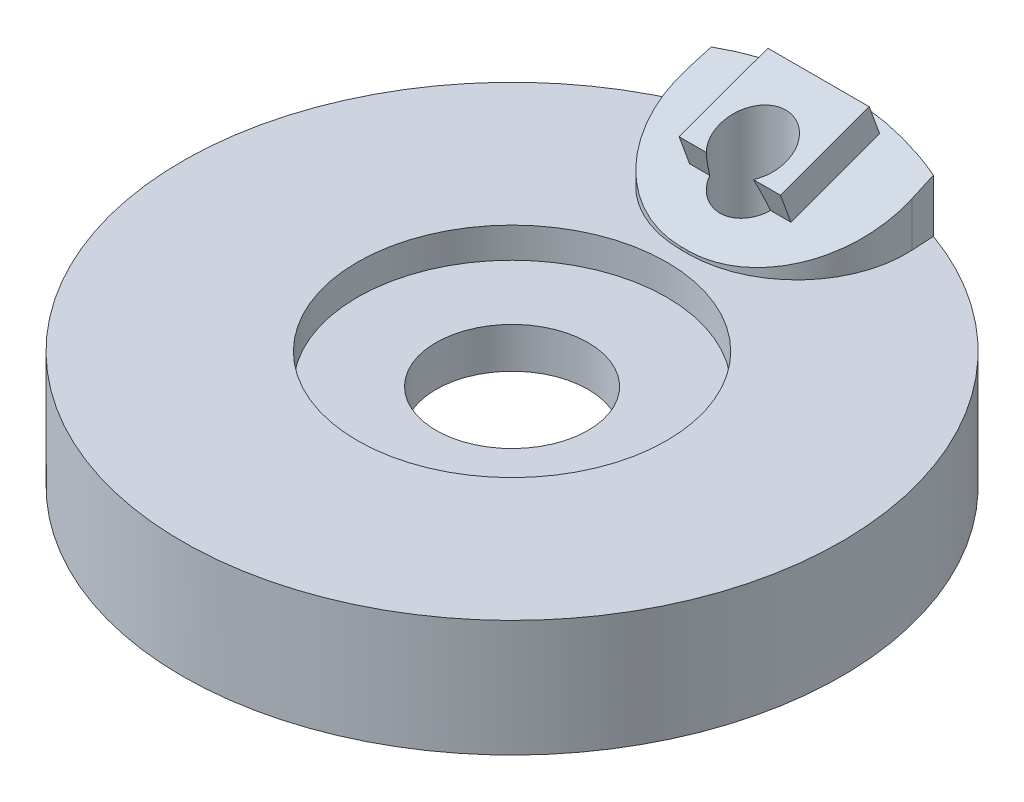
from build123d import *

# Parameters (mm, degrees)
BOSS_EXTRUDE1_START  = 47.2
SKETCH1_R            = 13
BOSS_EXTRUDE1_DEPTH  = 4.6
BOSS_EXTRUDE2_START  = -5.5
BOSS_EXTRUDE2_DEPTH  = 11
BOSS_EXTRUDE3_START  = -2
BOSS_EXTRUDE3_DEPTH  = 4
BOSS_EXTRUDE4_START  = 51.8
SKETCH4_R            = 25
SKETCH4_R_2          = 13
BOSS_EXTRUDE4_DEPTH  = 6.2
BOSS_EXTRUDE5_START  = 51.8
SKETCH5_W            = 40
SKETCH5_H            = 100
BOSS_EXTRUDE5_DEPTH  = 6.2
BOSS_EXTRUDE6_START  = 46.7
BOSS_EXTRUDE6_DEPTH  = 2.3
BOSS_EXTRUDE7_START  = 46.7
BOSS_EXTRUDE7_DEPTH  = 2.3
BOSS_EXTRUDE8_START  = 46.7
SKETCH8_R            = 4.6
BOSS_EXTRUDE8_DEPTH  = 2.3
BOSS_EXTRUDE9_START  = 48.9
SKETCH9_R            = 3
BOSS_EXTRUDE9_DEPTH  = 1.8
BOSS_EXTRUDE10_START = 50.6
SKETCH10_R           = 6.1
BOSS_EXTRUDE10_DEPTH = 1.7
BOSS_EXTRUDE11_START = 48.9
BOSS_EXTRUDE11_DEPTH = 1.9
BOSS_EXTRUDE12_START = 48.9
BOSS_EXTRUDE12_DEPTH = 1.9
BOSS_EXTRUDE13_START = 48.9
BOSS_EXTRUDE13_DEPTH = 1.9
BOSS_EXTRUDE14_START = 48.9
BOSS_EXTRUDE14_DEPTH = 1.9
BOSS_EXTRUDE15_START = 47.1
SKETCH15_R           = 2.2
BOSS_EXTRUDE15_DEPTH = 1.9
BOSS_EXTRUDE16_START = 48.9
SKETCH16_R           = 1.3
BOSS_EXTRUDE16_DEPTH = 9.1


with BuildPart() as part:
    # Sketch1 → Boss-Extrude1 (new body)
    with BuildSketch(Plane(origin=(0, 0, 0), x_dir=(1, 0, 0), z_dir=(0, 1, 0)).offset(BOSS_EXTRUDE1_START)):
        with Locations(Location((0, 62, 0), (0, 0, 270))):
            Circle(SKETCH1_R)
    extrude(amount=BOSS_EXTRUDE1_DEPTH)

    # Sketch2 → Boss-Extrude2 (add)
    with BuildSketch(Plane(origin=(0, 0, 0), x_dir=(0, 0, -1), z_dir=(1, 0, 0)).offset(BOSS_EXTRUDE2_START)):
        Polygon((68.5, 51.8), (76.5, 51.8), (76.5, 54.711761874), align=None)
    extrude(amount=BOSS_EXTRUDE2_DEPTH)

    # Sketch3 → Boss-Extrude3 (add)
    with BuildSketch(Plane(origin=(0, 0, 0), x_dir=(0, 0, -1), z_dir=(1, 0, 0)).offset(BOSS_EXTRUDE3_START)):
        Polygon((71.017101007, 52.662940955), (74.517101007, 53.936836775), (74.089575828, 55.111452551), (70.589575828, 53.837556731), align=None)
    extrude(amount=BOSS_EXTRUDE3_DEPTH)


with BuildPart() as body_2:
    # Sketch4 → Boss-Extrude4 (new body)
    with BuildSketch(Plane(origin=(0, 0, 0), x_dir=(1, 0, 0), z_dir=(0, 1, 0)).offset(BOSS_EXTRUDE4_START)):
        with Locations(Location((0, 62, 0), (0, 0, 270))):
            Circle(SKETCH4_R)
        with Locations(Location((0, 62, 0), (0, 0, 270))):
            Circle(SKETCH4_R_2, mode=Mode.SUBTRACT)
    extrude(amount=BOSS_EXTRUDE4_DEPTH)


with BuildPart() as part_1:
    add(part.part)

    # Combine1: cut body 2
    add(body_2.part, mode=Mode.SUBTRACT)


with BuildPart() as body_2_2:
    # Sketch5 → Boss-Extrude5 (new body)
    with BuildSketch(Plane(origin=(0, 0, 0), x_dir=(1, 0, 0), z_dir=(0, 1, 0)).offset(BOSS_EXTRUDE5_START)):
        with Locations((0, 90)):
            Rectangle(SKETCH5_W, SKETCH5_H)
        with BuildLine():
            Line((-0.141041229, 68.8), (0.141041229, 68.8))
            ThreePointArc((0.141041229, 68.8), (3.2691437, 70.149580551), (4.433699076, 73.351174452))
            Line((4.433699076, 73.351174452), (2.310189394, 109.642685883))
            ThreePointArc((2.310189394, 109.642685883), (1.685892465, 110.980791938), (0.313604349, 111.525860556))
            Line((0.313604349, 111.525860556), (-0.313604349, 111.525860556))
            ThreePointArc((-0.313604349, 111.525860556), (-1.685892465, 110.980791938), (-2.310189394, 109.642685883))
            Line((-2.310189394, 109.642685883), (-4.433699076, 73.351174452))
            ThreePointArc((-4.433699076, 73.351174452), (-3.2691437, 70.149580551), (-0.141041229, 68.8))
        make_face(mode=Mode.SUBTRACT)
    extrude(amount=BOSS_EXTRUDE5_DEPTH)


with BuildPart() as part_2:
    add(part_1.part)

    # Combine2: cut body 2 2
    add(body_2_2.part, mode=Mode.SUBTRACT)


with BuildPart() as body_2_3:
    # Sketch6 → Boss-Extrude6 (new body)
    with BuildSketch(Plane(origin=(0, 0, 0), x_dir=(1, 0, 0), z_dir=(0, 1, 0)).offset(BOSS_EXTRUDE6_START)):
        Polygon((-5.798275606, 72.465180362), (10.465180362, 56.201724394), (5.798275606, 51.534819638), (-10.465180362, 67.798275606), align=None)
    extrude(amount=BOSS_EXTRUDE6_DEPTH)


with BuildPart() as part_3:
    add(part_2.part)

    # Combine3: cut body 2 3
    add(body_2_3.part, mode=Mode.SUBTRACT)


with BuildPart() as body_2_4:
    # Sketch7 → Boss-Extrude7 (new body)
    with BuildSketch(Plane(origin=(0, 0, 0), x_dir=(1, 0, 0), z_dir=(0, 1, 0)).offset(BOSS_EXTRUDE7_START)):
        Polygon((10.465180362, 67.798275606), (-5.798275606, 51.534819638), (-10.465180362, 56.201724394), (5.798275606, 72.465180362), align=None)
    extrude(amount=BOSS_EXTRUDE7_DEPTH)


with BuildPart() as part_4:
    add(part_3.part)

    # Combine4: cut body 2 4
    add(body_2_4.part, mode=Mode.SUBTRACT)


with BuildPart() as body_2_5:
    # Sketch8 → Boss-Extrude8 (new body)
    with BuildSketch(Plane(origin=(0, 0, 0), x_dir=(1, 0, 0), z_dir=(0, 1, 0)).offset(BOSS_EXTRUDE8_START)):
        with Locations(Location((0, 62, 0), (0, 0, 270))):
            Circle(SKETCH8_R)
    extrude(amount=BOSS_EXTRUDE8_DEPTH)


with BuildPart() as part_5:
    add(part_4.part)

    # Combine5: cut body 2 5
    add(body_2_5.part, mode=Mode.SUBTRACT)


with BuildPart() as body_2_6:
    # Sketch9 → Boss-Extrude9 (new body)
    with BuildSketch(Plane(origin=(0, 0, 0), x_dir=(1, 0, 0), z_dir=(0, 1, 0)).offset(BOSS_EXTRUDE9_START)):
        with Locations(Location((0, 62, 0), (0, 0, 90))):
            Circle(SKETCH9_R)
    extrude(amount=BOSS_EXTRUDE9_DEPTH)


with BuildPart() as part_6:
    add(part_5.part)

    # Combine6: cut body 2 6
    add(body_2_6.part, mode=Mode.SUBTRACT)


with BuildPart() as body_2_7:
    # Sketch10 → Boss-Extrude10 (new body)
    with BuildSketch(Plane(origin=(0, 0, 0), x_dir=(1, 0, 0), z_dir=(0, 1, 0)).offset(BOSS_EXTRUDE10_START)):
        with Locations(Location((0, 62, 0), (0, 0, 270))):
            Circle(SKETCH10_R)
    extrude(amount=BOSS_EXTRUDE10_DEPTH)


with BuildPart() as part_7:
    add(part_6.part)

    # Combine7: cut body 2 7
    add(body_2_7.part, mode=Mode.SUBTRACT)


with BuildPart() as body_2_8:
    # Sketch11 → Boss-Extrude11 (new body)
    with BuildSketch(Plane(origin=(0, 0, 0), x_dir=(1, 0, 0), z_dir=(0, 1, 0)).offset(BOSS_EXTRUDE11_START)):
        Polygon((5.374011537, 57.898780669), (7.707463915, 55.565328291), (6.434671709, 54.292536085), (4.101219331, 56.625988463), align=None)
    extrude(amount=BOSS_EXTRUDE11_DEPTH)


with BuildPart() as part_8:
    add(part_7.part)

    # Combine8: cut body 2 8
    add(body_2_8.part, mode=Mode.SUBTRACT)


with BuildPart() as body_2_9:
    # Sketch12 → Boss-Extrude12 (new body)
    with BuildSketch(Plane(origin=(0, 0, 0), x_dir=(1, 0, 0), z_dir=(0, 1, 0)).offset(BOSS_EXTRUDE12_START)):
        Polygon((-4.101219331, 56.625988463), (-6.434671709, 54.292536085), (-7.707463915, 55.565328291), (-5.374011537, 57.898780669), align=None)
    extrude(amount=BOSS_EXTRUDE12_DEPTH)


with BuildPart() as part_9:
    add(part_8.part)

    # Combine9: cut body 2 9
    add(body_2_9.part, mode=Mode.SUBTRACT)


with BuildPart() as body_2_10:
    # Sketch13 → Boss-Extrude13 (new body)
    with BuildSketch(Plane(origin=(0, 0, 0), x_dir=(1, 0, 0), z_dir=(0, 1, 0)).offset(BOSS_EXTRUDE13_START)):
        Polygon((-5.374011537, 66.101219331), (-7.707463915, 68.434671709), (-6.434671709, 69.707463915), (-4.101219331, 67.374011537), align=None)
    extrude(amount=BOSS_EXTRUDE13_DEPTH)


with BuildPart() as part_10:
    add(part_9.part)

    # Combine10: cut body 2 10
    add(body_2_10.part, mode=Mode.SUBTRACT)


with BuildPart() as body_2_11:
    # Sketch14 → Boss-Extrude14 (new body)
    with BuildSketch(Plane(origin=(0, 0, 0), x_dir=(1, 0, 0), z_dir=(0, 1, 0)).offset(BOSS_EXTRUDE14_START)):
        Polygon((4.101219331, 67.374011537), (6.434671709, 69.707463915), (7.707463915, 68.434671709), (5.374011537, 66.101219331), align=None)
    extrude(amount=BOSS_EXTRUDE14_DEPTH)


with BuildPart() as part_11:
    add(part_10.part)

    # Combine11: cut body 2 11
    add(body_2_11.part, mode=Mode.SUBTRACT)


with BuildPart() as body_2_12:
    # Sketch15 → Boss-Extrude15 (new body)
    with BuildSketch(Plane(origin=(0, 0, 0), x_dir=(1, 0, 0), z_dir=(0, 1, 0)).offset(BOSS_EXTRUDE15_START)):
        with Locations(Location((0, 71.5, 0), (0, 0, 270))):
            Circle(SKETCH15_R)
    extrude(amount=BOSS_EXTRUDE15_DEPTH)


with BuildPart() as part_12:
    add(part_11.part)

    # Combine12: cut body 2 12
    add(body_2_12.part, mode=Mode.SUBTRACT)


with BuildPart() as body_2_13:
    # Sketch16 → Boss-Extrude16 (new body)
    with BuildSketch(Plane(origin=(0, 0, 0), x_dir=(1, 0, 0), z_dir=(0, 1, 0)).offset(BOSS_EXTRUDE16_START)):
        with Locations(Location((0, 71.5, 0), (0, 0, 270))):
            Circle(SKETCH16_R)
    extrude(amount=BOSS_EXTRUDE16_DEPTH)


with BuildPart() as part_13:
    add(part_12.part)

    # Combine13: cut body 2 13
    add(body_2_13.part, mode=Mode.SUBTRACT)


solid = part_13.part
